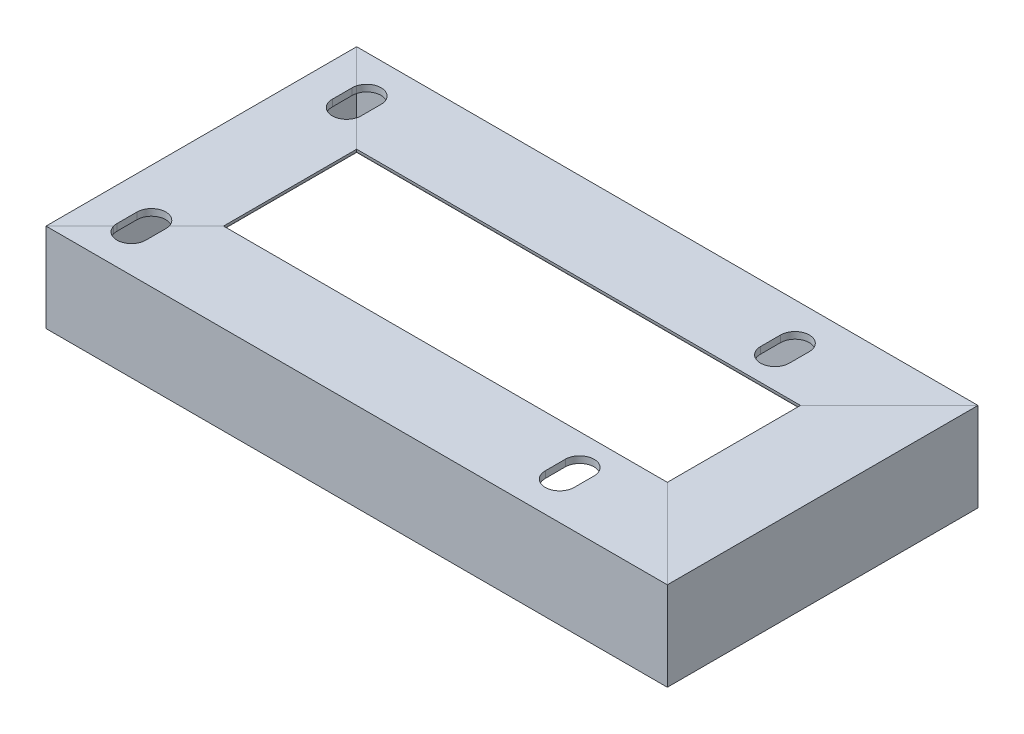
from build123d import *

# Parameters (mm, degrees)
IRON_V40X40X3_1_DEPTH      = 197.568542495
IRON_V40X40X3_1_DEPTH_BACK = 57.568542495
IRON_V40X40X3_1_2_DEPTH    = 395.13708499
IRON_V40X40X3_1_3_DEPTH    = 255.13708499
IRON_V40X40X3_1_4_DEPTH    = 395.13708499
CUT_EXTRUDE1_DEPTH         = 10


with BuildPart() as part:
    # Sketch1 → Iron V40X40X3(1) (new, two sides: drawn at the far end of the back side and taken through both)
    with BuildSketch(Plane(origin=(-140, 0, 70), x_dir=(1, 0, 0), z_dir=(0, 0, -1)).offset(-IRON_V40X40X3_1_DEPTH_BACK)):
        with BuildLine():
            Line((0, 0), (0, 40))
            ThreePointArc((0, 40), (2.121320344, 39.121320344), (3, 37))
            Line((3, 37), (3, 6.5))
            ThreePointArc((3, 6.5), (4.025126266, 4.025126266), (6.5, 3))
            Line((6.5, 3), (37, 3))
            ThreePointArc((37, 3), (39.121320344, 2.121320344), (40, 0))
            Line((40, 0), (0, 0))
        make_face()
    extrude(amount=IRON_V40X40X3_1_DEPTH + IRON_V40X40X3_1_DEPTH_BACK)

    # Iron V40X40X3(1) mitre 1
    split(bisect_by=Plane(origin=(-140, 0, 70), x_dir=(0, -1, 0), z_dir=(-0.707106781, 0, -0.707106781)), keep=Keep.TOP)

    # Iron V40X40X3(1) mitre 2
    split(bisect_by=Plane(origin=(-140, 0, -70), x_dir=(0, -1, 0), z_dir=(-0.707106781, 0, 0.707106781)), keep=Keep.TOP)


with BuildPart() as body_2:
    # Sketch1 on segment 2 (carried to segment 2) → Iron V40X40X3_1 2 (new body)
    with BuildSketch(Plane(origin=(-197.568542495, 0, -70), x_dir=(0, 0, 1), z_dir=(1, 0, 0))):
        with BuildLine():
            Line((0, 0), (0, 40))
            ThreePointArc((0, 40), (2.121320344, 39.121320344), (3, 37))
            Line((3, 37), (3, 6.5))
            ThreePointArc((3, 6.5), (4.025126266, 4.025126266), (6.5, 3))
            Line((6.5, 3), (37, 3))
            ThreePointArc((37, 3), (39.121320344, 2.121320344), (40, 0))
            Line((40, 0), (0, 0))
        make_face()
    extrude(amount=IRON_V40X40X3_1_2_DEPTH)

    # Iron V40X40X3_1 2 mitre 1
    split(bisect_by=Plane(origin=(-140, 0, -70), x_dir=(0, 1, 0), z_dir=(0.707106781, 0, -0.707106781)), keep=Keep.TOP)

    # Iron V40X40X3_1 2 mitre 2
    split(bisect_by=Plane(origin=(140, 0, -70), x_dir=(0, -1, 0), z_dir=(-0.707106781, 0, -0.707106781)), keep=Keep.TOP)


with BuildPart() as body_3:
    # Sketch1 on segment 3 (carried to segment 3) → Iron V40X40X3_1 3 (new body)
    with BuildSketch(Plane(origin=(140, 0, -127.568542495), x_dir=(-1, 0, 0), z_dir=(0, 0, 1))):
        with BuildLine():
            Line((0, 0), (0, 40))
            ThreePointArc((0, 40), (2.121320344, 39.121320344), (3, 37))
            Line((3, 37), (3, 6.5))
            ThreePointArc((3, 6.5), (4.025126266, 4.025126266), (6.5, 3))
            Line((6.5, 3), (37, 3))
            ThreePointArc((37, 3), (39.121320344, 2.121320344), (40, 0))
            Line((40, 0), (0, 0))
        make_face()
    extrude(amount=IRON_V40X40X3_1_3_DEPTH)

    # Iron V40X40X3_1 3 mitre 1
    split(bisect_by=Plane(origin=(140, 0, 70), x_dir=(0, 1, 0), z_dir=(0.707106781, 0, -0.707106781)), keep=Keep.TOP)

    # Iron V40X40X3_1 3 mitre 2
    split(bisect_by=Plane(origin=(140, 0, -70), x_dir=(0, 1, 0), z_dir=(0.707106781, 0, 0.707106781)), keep=Keep.TOP)


with BuildPart() as body_4:
    # Sketch1 on segment 4 (carried to segment 4) → Iron V40X40X3_1 4 (new body)
    with BuildSketch(Plane(origin=(197.568542495, 0, 70), x_dir=(0, 0, -1), z_dir=(-1, 0, 0))):
        with BuildLine():
            Line((0, 0), (0, 40))
            ThreePointArc((0, 40), (2.121320344, 39.121320344), (3, 37))
            Line((3, 37), (3, 6.5))
            ThreePointArc((3, 6.5), (4.025126266, 4.025126266), (6.5, 3))
            Line((6.5, 3), (37, 3))
            ThreePointArc((37, 3), (39.121320344, 2.121320344), (40, 0))
            Line((40, 0), (0, 0))
        make_face()
    extrude(amount=IRON_V40X40X3_1_4_DEPTH)

    # Iron V40X40X3_1 4 mitre 1
    split(bisect_by=Plane(origin=(-140, 0, 70), x_dir=(0, 1, 0), z_dir=(0.707106781, 0, 0.707106781)), keep=Keep.TOP)

    # Iron V40X40X3_1 4 mitre 2
    split(bisect_by=Plane(origin=(140, 0, 70), x_dir=(0, -1, 0), z_dir=(-0.707106781, 0, 0.707106781)), keep=Keep.TOP)


with BuildPart() as cut_extrude1_tool:
    # Sketch2 → Cut-Extrude1 (new body)
    with BuildSketch(Plane(origin=(0, 0, 0), x_dir=(1, 0, 0), z_dir=(0, 1, 0))):
        with BuildLine():
            Line((81, 53), (81, 44))
            ThreePointArc((81, 44), (74.5, 37.5), (68, 44))
            Line((68, 44), (68, 53))
            ThreePointArc((68, 53), (74.5, 59.5), (81, 53))
        make_face()
        with BuildLine():
            Line((-112, 53), (-112, 44))
            ThreePointArc((-112, 44), (-118.5, 37.5), (-125, 44))
            Line((-125, 44), (-125, 53))
            ThreePointArc((-125, 53), (-118.5, 59.5), (-112, 53))
        make_face()
        with BuildLine():
            Line((-112, -44), (-112, -53))
            ThreePointArc((-112, -53), (-118.5, -59.5), (-125, -53))
            Line((-125, -53), (-125, -44))
            ThreePointArc((-125, -44), (-118.5, -37.5), (-112, -44))
        make_face()
        with BuildLine():
            Line((81, -44), (81, -53))
            ThreePointArc((81, -53), (74.5, -59.5), (68, -53))
            Line((68, -53), (68, -44))
            ThreePointArc((68, -44), (74.5, -37.5), (81, -44))
        make_face()
    extrude(amount=-CUT_EXTRUDE1_DEPTH)


with BuildPart() as part_1:
    add(part.part)

    # Cut-Extrude1: cut by cut_extrude1_tool
    add(cut_extrude1_tool.part, mode=Mode.SUBTRACT)


with BuildPart() as body_2_1:
    add(body_2.part)

    # Cut-Extrude1: cut by cut_extrude1_tool
    add(cut_extrude1_tool.part, mode=Mode.SUBTRACT)


with BuildPart() as body_4_1:
    add(body_4.part)

    # Cut-Extrude1: cut by cut_extrude1_tool
    add(cut_extrude1_tool.part, mode=Mode.SUBTRACT)


solid = Compound([body_3.part, part_1.part, body_2_1.part, body_4_1.part])
